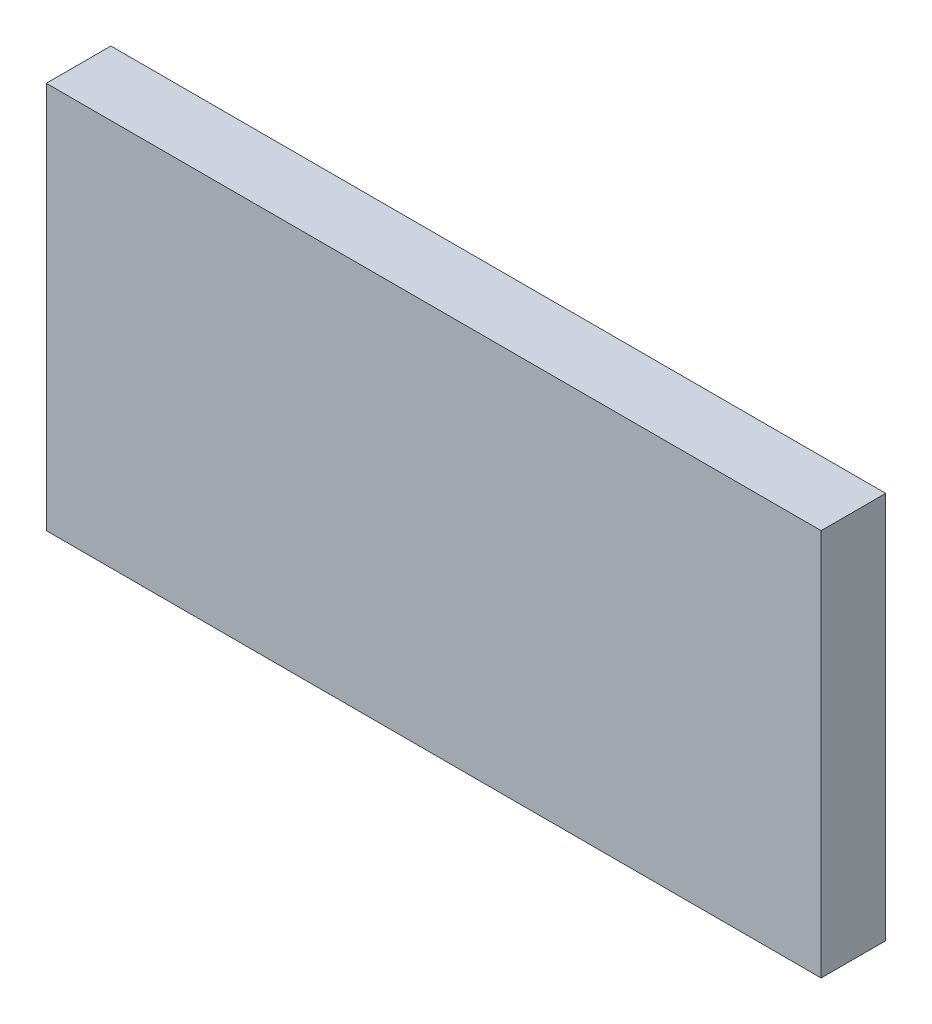
from build123d import *

# Parameters (mm, degrees)
ESQUISSE1_W        = 60
ESQUISSE1_H        = 30
BOSS_EXTRU_1_DEPTH = 5


with BuildPart() as part:
    # Esquisse1 → Boss.-Extru.1 (new body)
    with BuildSketch(Plane.XY):
        with Locations((30, 15)):
            Rectangle(ESQUISSE1_W, ESQUISSE1_H)
    extrude(amount=BOSS_EXTRU_1_DEPTH)


solid = part.part
